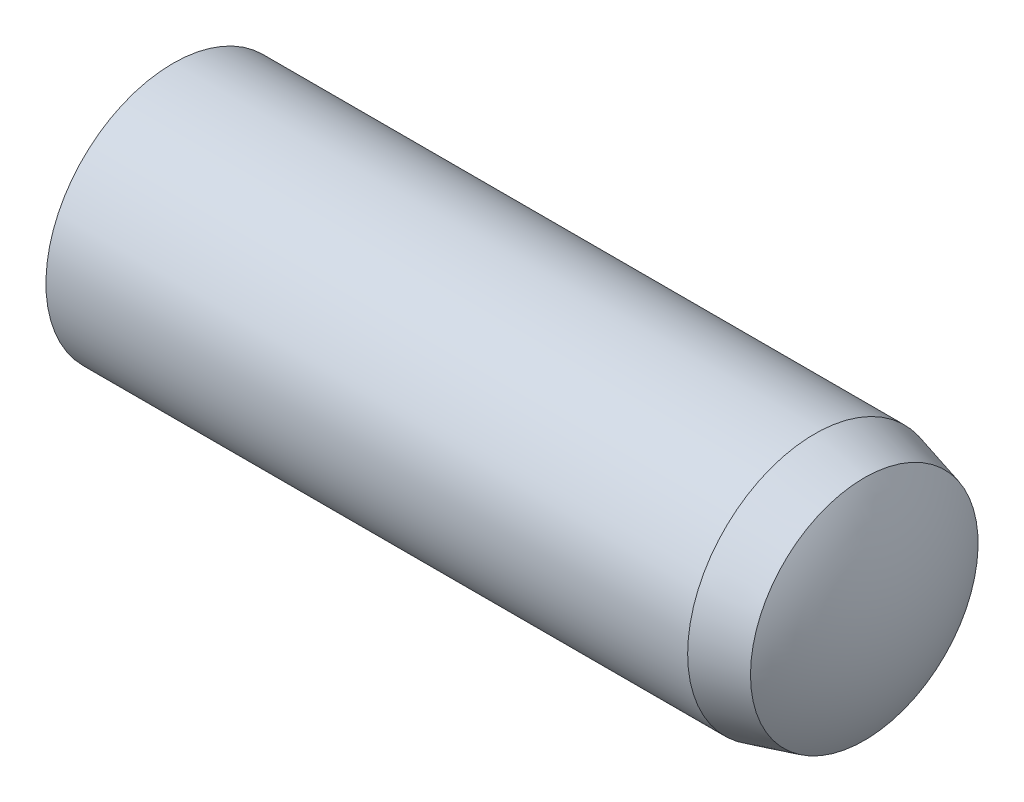
from build123d import *

# Parameters (mm, degrees)
EXTRUDE1_DEPTH      = 12
EXTRUDE1_DEPTH_BACK = 12
SKETCH2_R           = 4


with BuildPart() as part:
    # Sketch2 → Extrude1 (new, two sides: drawn at the far end of the back side and taken through both)
    with BuildSketch(Plane(origin=(0, 0, 0), x_dir=(0, 0, -1), z_dir=(1, 0, 0)).offset(-EXTRUDE1_DEPTH_BACK)):
        Circle(SKETCH2_R)
    extrude(amount=EXTRUDE1_DEPTH + EXTRUDE1_DEPTH_BACK)

    # Sketch5 → Cut-Revolve1 (revolve, cut)
    with BuildSketch(Plane.XY):
        with BuildLine():
            Line((9.4, 4), (9.4, 4.5))
            Line((9.4, 4.5), (12.5, 4.5))
            Line((12.5, 4.5), (12.5, 0))
            Line((12.5, 0), (12, 0))
            ThreePointArc((12, 0), (11.734740106, 1.864961038), (10.96, 3.58199926))
            Line((10.96, 3.58199926), (9.4, 4))
        make_face()
        with BuildLine():
            Line((-10.8, 4), (-10.8, 4.5))
            Line((-10.8, 4.5), (-12.5, 4.5))
            Line((-12.5, 4.5), (-12.5, 0))
            Line((-12.5, 0), (-12, 0))
            ThreePointArc((-12, 0), (-11.693537673, 2.088061302), (-10.8, 4))
        make_face()
    revolve(axis=Axis((-12, 0, 0), (1, 0, 0)), mode=Mode.SUBTRACT)


solid = part.part
